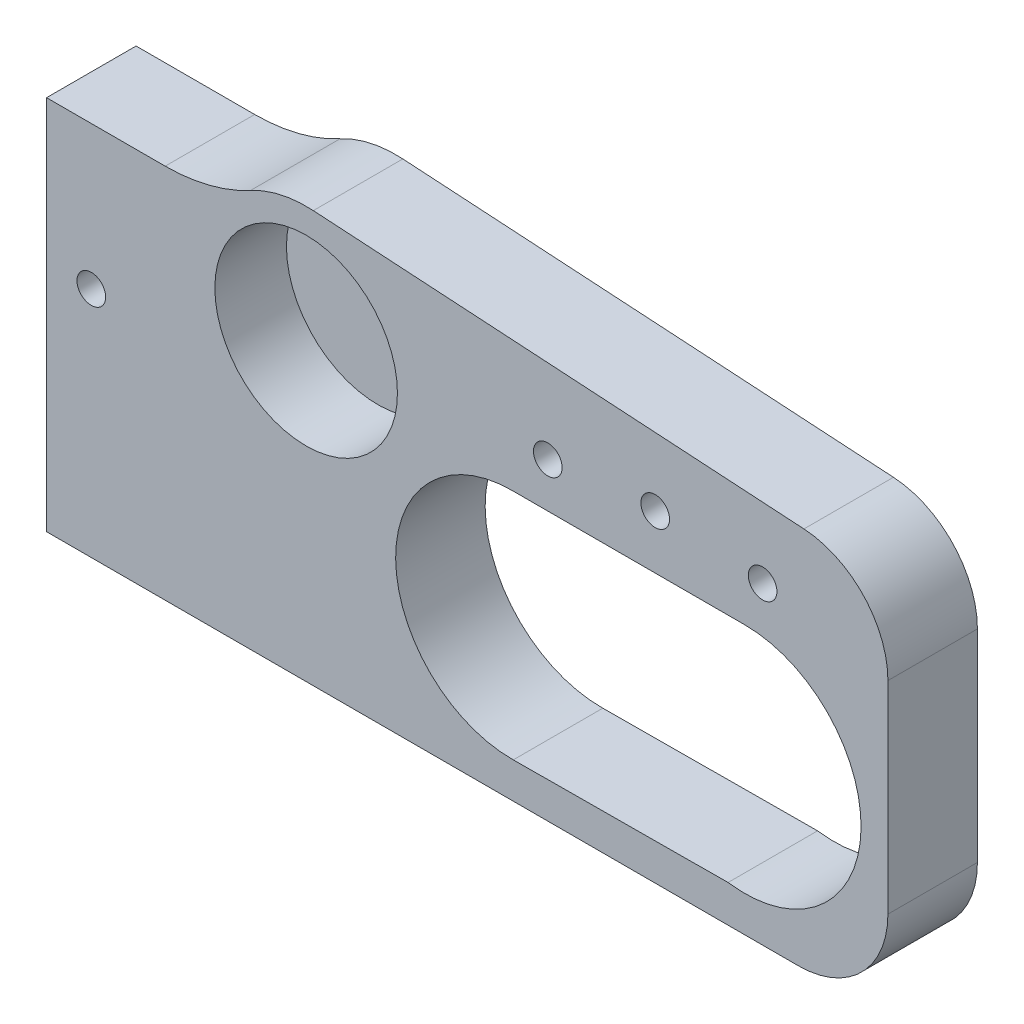
from build123d import *

# Parameters (mm, degrees)
SKETCH1_R           = 0.8
SKETCH1_R_2         = 5.1
BOSS_EXTRUDE1_DEPTH = 5
SKETCH2_R           = 1.25
CUT_EXTRUDE1_DEPTH  = 5
SKETCH21_R          = 5.1
BOSS_EXTRUDE2_DEPTH = 1


with BuildPart() as part:
    # Sketch1 → Boss-Extrude1 (new body)
    with BuildSketch(Plane(origin=(0, 0, 0), x_dir=(0, 1, 0), z_dir=(0, 0, 1))):
        with BuildLine():
            ThreePointArc((7.923715338, -23.061842121), (11.348253353, -21.704991773), (12.914157128, -18.370857874))
            Line((12.914157128, -18.370857874), (14.611258571, 9.036437401))
            ThreePointArc((14.611258571, 9.036437401), (14.470096631, 10.842810788), (13.835805455, 12.540039768))
            ThreePointArc((13.835805455, 12.540039768), (12.931450551, 14.850335933), (12.623684243, 17.312165753))
            Line((12.623684243, 17.312165753), (12.623684243, 23.938157879))
            Line((12.623684243, 23.938157879), (-8.376315757, 23.938157879))
            Line((-8.376315757, 23.938157879), (-8.376315757, -18.061842121))
            ThreePointArc((-8.376315757, -18.061842121), (-6.911849663, -21.597376027), (-3.376315757, -23.061842121))
            Line((-3.376315757, -23.061842121), (7.923715338, -23.061842121))
        make_face()
        with BuildLine():
            Line((-6.37591859, -2.133696229), (-6.376315757, -2.061842121))
            ThreePointArc((-6.376315757, -2.061842121), (0.123684243, 4.438157879), (6.623684243, -2.061842121))
            Line((6.623684243, -2.061842121), (6.623684243, -15.061842121))
            ThreePointArc((6.623684243, -15.061842121), (0.625179068, -21.542467318), (-6.298932046, -16.061842121))
            ThreePointArc((-6.298932046, -16.061842121), (-6.376216465, -15.097769724), (-6.309594086, -14.132901895))
            Line((-6.309594086, -14.132901895), (-6.37591859, -2.133696229))
        make_face(mode=Mode.SUBTRACT)
        with Locations(Location((9.123684243, -16.061842121, 0), (0, 0, 270))):
            Circle(SKETCH1_R, mode=Mode.SUBTRACT)
        with Locations(Location((9.623684243, -10.061842121, 0), (0, 0, 270))):
            Circle(SKETCH1_R, mode=Mode.SUBTRACT)
        with Locations(Location((9.123684243, -4.061842121, 0), (0, 0, 270))):
            Circle(SKETCH1_R, mode=Mode.SUBTRACT)
        with Locations(Location((8.123684243, 9.438157879, 0), (0, 0, 270))):
            Circle(SKETCH1_R_2, mode=Mode.SUBTRACT)
        with Locations(Location((4.623684243, 21.438157879, 0), (0, 0, 270))):
            Circle(SKETCH1_R, mode=Mode.SUBTRACT)
    extrude(amount=BOSS_EXTRUDE1_DEPTH)

    # Sketch2 → Cut-Extrude1 (cut)
    with BuildSketch(Plane(origin=(-23.938157879, 0, 0), x_dir=(0, -1, 0), z_dir=(-1, 0, 0))):
        with Locations(Location((-9.623684243, 2.5, 0), (0, 0, 90))):
            Circle(SKETCH2_R)
        with Locations(Location((5.376315757, 2.5, 0), (0, 0, 90))):
            Circle(SKETCH2_R)
    extrude(amount=-CUT_EXTRUDE1_DEPTH, mode=Mode.SUBTRACT)

    # Sketch21 → Boss-Extrude2 (add)
    with BuildSketch(Plane(origin=(0, 0, 0), x_dir=(1, 0, 0), z_dir=(0, 0, -1))):
        with Locations(Location((-9.438157879, -8.123684243, 0), (0, 0, 180))):
            Circle(SKETCH21_R)
    extrude(amount=-BOSS_EXTRUDE2_DEPTH)


solid = part.part
